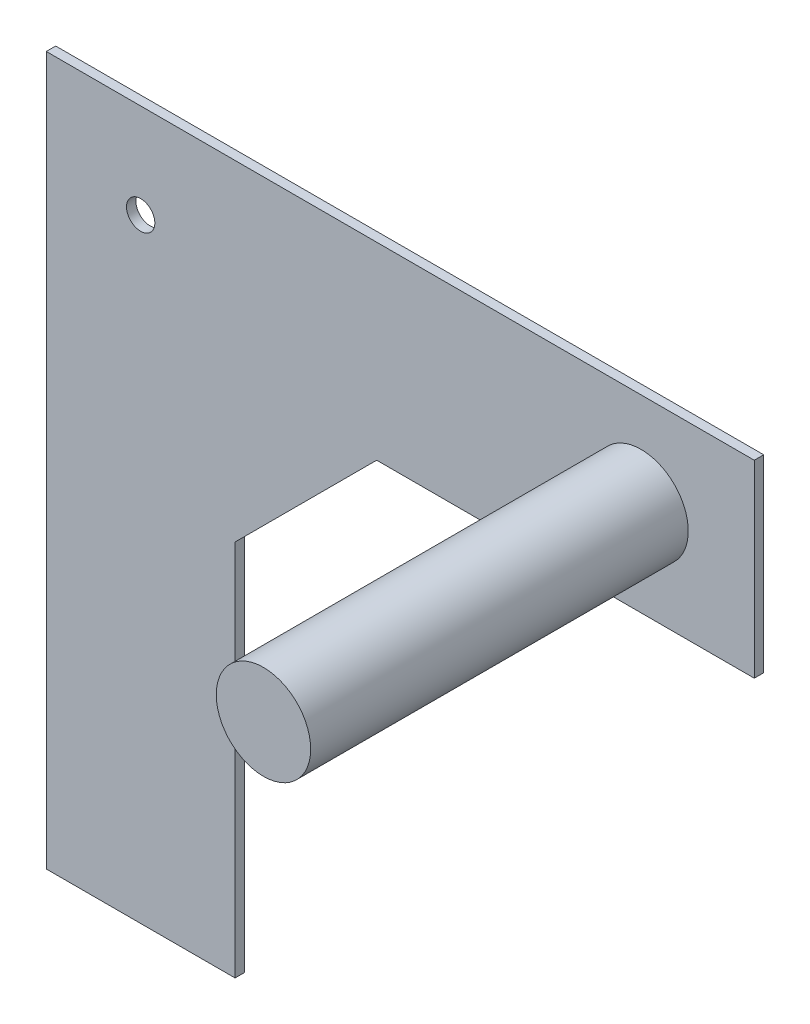
from build123d import *

# Parameters (mm, degrees)
BOSS_EXTRUDE1_DEPTH = 1
SKETCH4_R           = 1.5
CUT_EXTRUDE5_DEPTH  = 1
SKETCH5_R           = 5
BOSS_EXTRUDE2_DEPTH = 40


with BuildPart() as part:
    # Sketch1 → Boss-Extrude1 (new body)
    with BuildSketch(Plane.XY):
        Polygon((-20, 35), (-20, -40), (0, -40), (0, 0), (15, 15), (55, 15), (55, 35), align=None)
    extrude(amount=BOSS_EXTRUDE1_DEPTH)

    # Sketch4 → Cut-Extrude5 (cut)
    with BuildSketch(Plane.XY.offset(1)):
        with Locations((-10, 25.000149563)):
            Circle(SKETCH4_R)
    extrude(amount=-CUT_EXTRUDE5_DEPTH, mode=Mode.SUBTRACT)

    # Sketch5 → Boss-Extrude2 (add)
    with BuildSketch(Plane.XY.offset(1)):
        with Locations(Location((43.007008147, 25, 0), (0, 0, 180))):
            Circle(SKETCH5_R)
    extrude(amount=BOSS_EXTRUDE2_DEPTH)


solid = part.part
